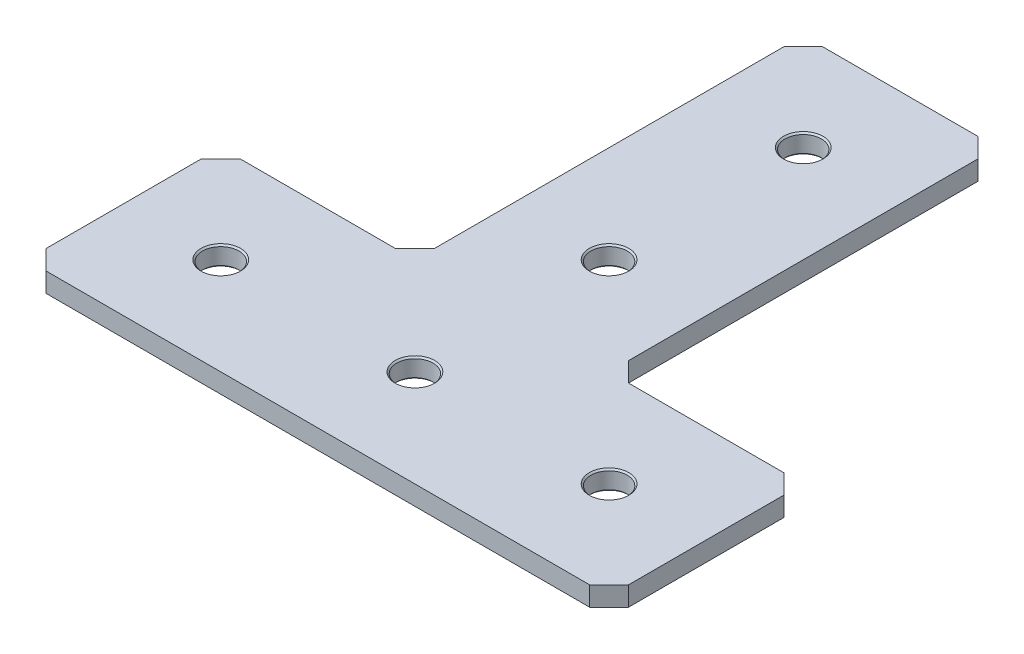
from build123d import *

# Parameters (mm, degrees)
BOSS_EXTRUDE1_DEPTH            = 2.54
F_3_16_0_1875_DIAMETER_HOLE1_D = 4.7625
CHAMFER1_SIZE                  = 2.54
CHAMFER2_SIZE                  = 0.2


with BuildPart() as part:
    # Sketch1 → Boss-Extrude1 (new body)
    with BuildSketch(Plane(origin=(0, 0, 0), x_dir=(1, 0, 0), z_dir=(0, 1, 0))):
        Polygon((0, 0), (-25.4, 0), (-25.4, -25.4), (50.8, -25.4), (50.8, 0), (25.4, 0), (25.4, 50.8), (0, 50.8), align=None)
    extrude(amount=BOSS_EXTRUDE1_DEPTH)

    # 3/16 (0.1875) Diameter Hole1 (through all)
    with Locations(Plane(origin=(0, 2.54, 0), x_dir=(1, 0, 0), z_dir=(0, 1, 0))):
        with Locations((12.7, 38.1), (12.7, 12.7), (12.7, -12.7), (38.1, -12.7), (-12.7, -12.7)):
            Hole(F_3_16_0_1875_DIAMETER_HOLE1_D / 2)

    # Chamfer1
    chamfer1_edges = [part.edges().sort_by_distance(p)[0] for p in [
        (0, 1.27, -50.8),
        (25.4, 1.27, -50.8),
        (25.4, 1.27, 0),
        (50.8, 1.27, 0),
        (50.8, 1.27, 25.4),
        (-25.4, 1.27, 25.4),
        (-25.4, 1.27, 0),
        (0, 1.27, 0),
    ]]
    chamfer(chamfer1_edges, length=CHAMFER1_SIZE)

    # Chamfer2
    chamfer2_edges = [part.edges().sort_by_distance(p)[0] for p in [
        (-10.31875, 2.54, 12.7),
        (-10.31875, 0, 12.7),
        (40.48125, 2.54, 12.7),
        (40.48125, 0, 12.7),
        (15.08125, 2.54, 12.7),
        (15.08125, 0, 12.7),
        (15.08125, 2.54, -12.7),
        (15.08125, 0, -12.7),
        (15.08125, 2.54, -38.1),
        (15.08125, 0, -38.1),
    ]]
    chamfer(chamfer2_edges, length=CHAMFER2_SIZE)


solid = part.part
